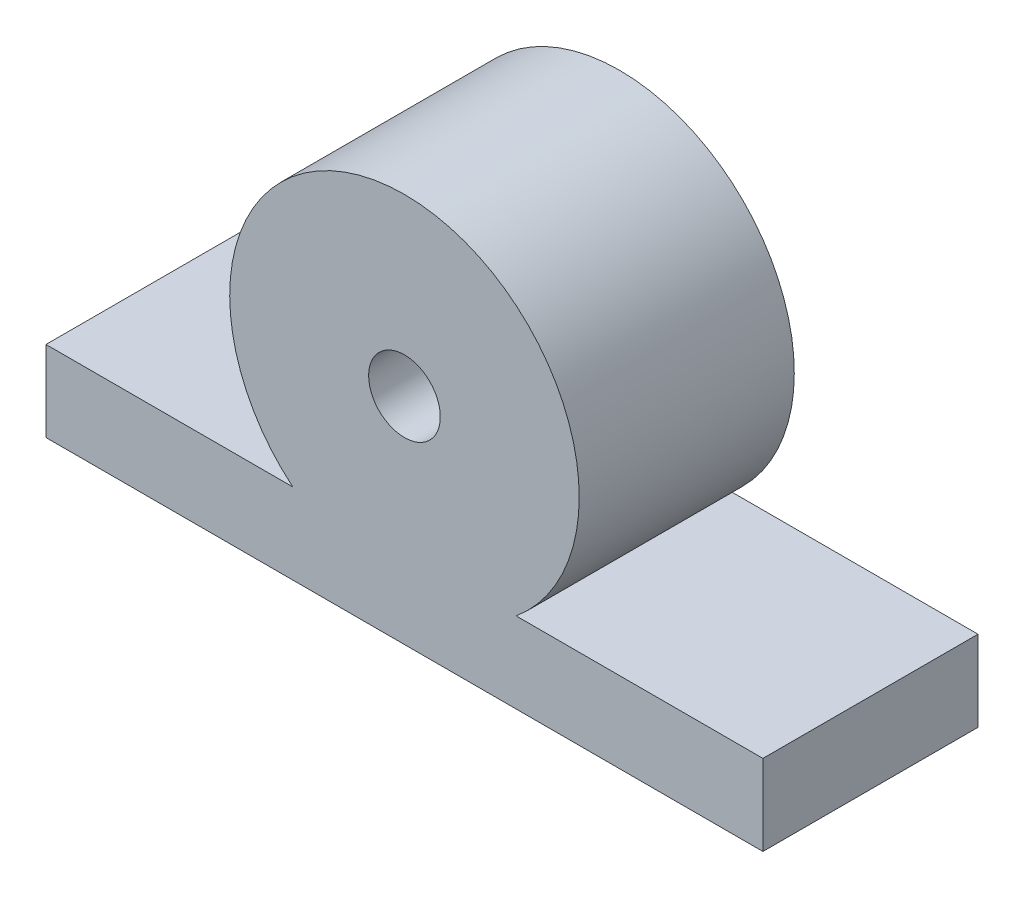
from build123d import *

# Parameters (mm, degrees)
SKETCH1_R           = 30.95625
SKETCH1_R_2         = 6.35
BOSS_EXTRUDE1_DEPTH = 38.1


with BuildPart() as part:
    # Sketch1 → Boss-Extrude1 (new body)
    # profile 1 of 2: a face of its own
    with BuildSketch(Plane.XY):
        with Locations((0, 38.1)):
            Circle(SKETCH1_R)
        with Locations(Location((0, 38.1, 0), (0, 0, 180))):
            Circle(SKETCH1_R_2, mode=Mode.SUBTRACT)
    # profile 2 of 2: a face of its own
    with BuildSketch(Plane.XY):
        with BuildLine():
            Line((-63.5, 14.2875), (-63.5, 0))
            Line((-63.5, 0), (63.5, 0))
            Line((63.5, 0), (63.5, 14.2875))
            Line((63.5, 14.2875), (19.780148074, 14.2875))
            ThreePointArc((19.780148074, 14.2875), (0, 7.14375), (-19.780148074, 14.2875))
            Line((-19.780148074, 14.2875), (-63.5, 14.2875))
        make_face()
    extrude(amount=BOSS_EXTRUDE1_DEPTH)


solid = part.part
